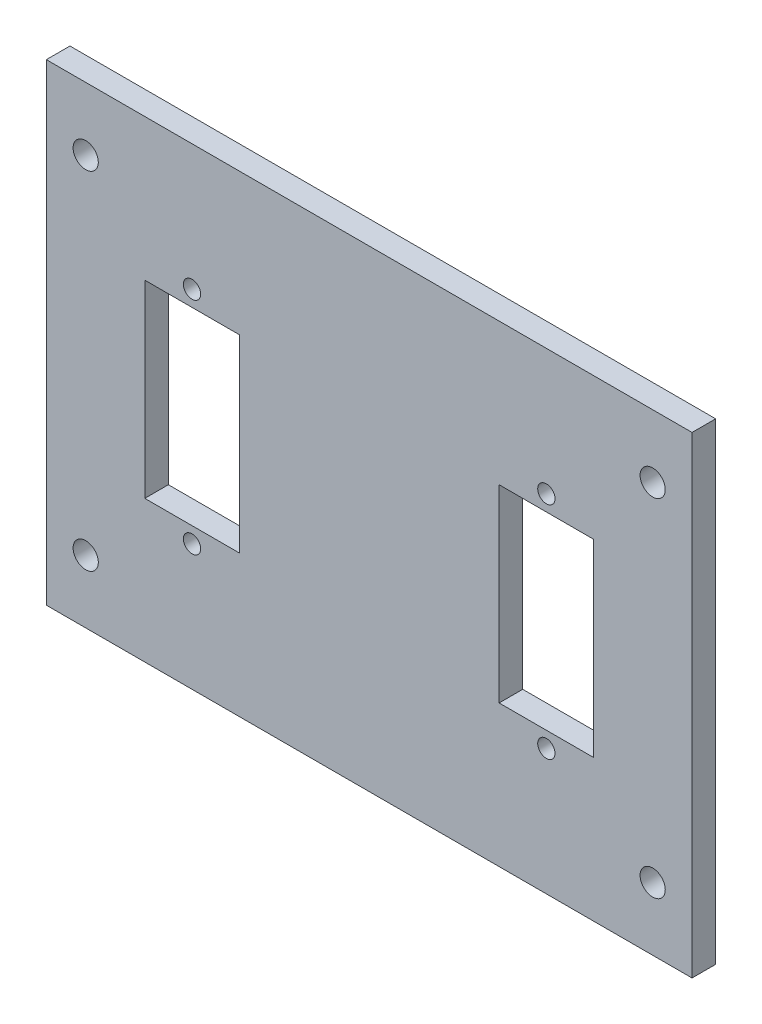
from build123d import *

# Parameters (mm, degrees)
SKETCH_1_W      = 82
SKETCH_1_H      = 60
SKETCH_1_R      = 1.1
SKETCH_1_R_2    = 1.6
SKETCH_1_W_2    = 12
SKETCH_1_H_2    = 24
EXTRUDE_1_DEPTH = 3


with BuildPart() as part:
    # 草图1 → 凸台-拉伸1 (new body)
    with BuildSketch(Plane.XY):
        with Locations((41, 30)):
            Rectangle(SKETCH_1_W, SKETCH_1_H)
        with Locations((18.5, 44)):
            Circle(SKETCH_1_R, mode=Mode.SUBTRACT)
        with Locations(Location((18.5, 16, 0), (0, 0, 180))):
            Circle(SKETCH_1_R, mode=Mode.SUBTRACT)
        with Locations((77, 8)):
            Circle(SKETCH_1_R_2, mode=Mode.SUBTRACT)
        with Locations(Location((5, 8, 0), (0, 0, 180))):
            Circle(SKETCH_1_R_2, mode=Mode.SUBTRACT)
        with Locations(Location((77, 52, 0), (0, 0, 180))):
            Circle(SKETCH_1_R_2, mode=Mode.SUBTRACT)
        with Locations((5, 52)):
            Circle(SKETCH_1_R_2, mode=Mode.SUBTRACT)
        with Locations((63.5, 16)):
            Circle(SKETCH_1_R, mode=Mode.SUBTRACT)
        with Locations(Location((63.5, 44, 0), (0, 0, 180))):
            Circle(SKETCH_1_R, mode=Mode.SUBTRACT)
        with Locations((63.5, 30)):
            Rectangle(SKETCH_1_W_2, SKETCH_1_H_2, mode=Mode.SUBTRACT)
        with Locations((18.5, 30)):
            Rectangle(SKETCH_1_W_2, SKETCH_1_H_2, mode=Mode.SUBTRACT)
    extrude(amount=EXTRUDE_1_DEPTH)


solid = part.part
